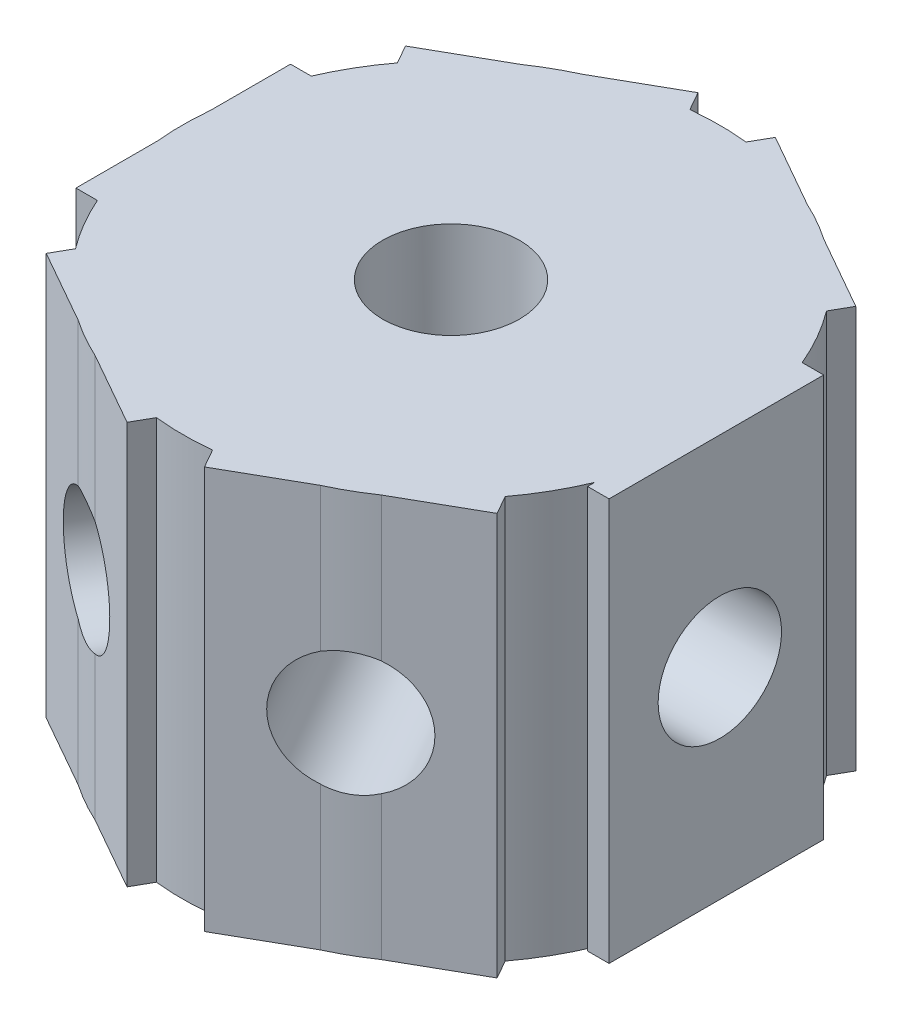
from build123d import *

# Parameters (mm, degrees)
SKETCH1_R               = 12.7
SKETCH1_R_2             = 3.2385
BOSS_EXTRUDE1_DEPTH     = 19.05
BOSS_EXTRUDE2_DEPTH     = 19.05
CUT_EXTRUDE1_DEPTH      = 37.389507521
CUT_EXTRUDE1_DEPTH_BACK = 37.389507521
SKETCH8_R               = 2.921
CUT_EXTRUDE2_DEPTH      = 39.543446664
CUT_EXTRUDE2_DEPTH_BACK = 39.543446664
SKETCH9_R               = 2.921
CUT_EXTRUDE3_DEPTH      = 39.543446664
CUT_EXTRUDE3_DEPTH_BACK = 39.543446664
SKETCH10_R              = 2.921


with BuildPart() as part:
    # Sketch1 → Boss-Extrude1 (new body)
    with BuildSketch(Plane(origin=(0, 0, 0), x_dir=(1, 0, 0), z_dir=(0, 1, 0))):
        with Locations(Location((0, 0, 0), (0, 0, 90))):
            Circle(SKETCH1_R)
        with Locations(Location((0, 0, 0), (0, 0, 90))):
            Circle(SKETCH1_R_2, mode=Mode.SUBTRACT)
    extrude(amount=BOSS_EXTRUDE1_DEPTH)

    # Sketch4 → Boss-Extrude2 (add)
    with BuildSketch(Plane(origin=(0, 0, 0), x_dir=(1, 0, 0), z_dir=(0, 1, 0))):
        with BuildLine():
            Line((11.710261251, -4.915260056), (11.710261251, -5.244739944))
            Line((11.710261251, -5.244739944), (12.726261251, -5.244739944))
            Line((12.726261251, -5.244739944), (12.726261251, 4.915260056))
            Line((12.726261251, 4.915260056), (11.710261251, 4.915260056))
            ThreePointArc((11.710261251, 4.915260056), (12.7, 0), (11.710261251, -4.915260056))
        make_face()
        with BuildLine():
            Line((10.672174567, -8.489929463), (10.169919899, -7.606755501))
            ThreePointArc((10.169919899, -7.606755501), (8.791502438, -9.165123288), (7.177147146, -10.477526371))
            Line((7.177147146, -10.477526371), (10.672174567, -8.489929463))
        make_face()
        with BuildLine():
            Line((10.122975303, 7.669118008), (10.169919899, 7.606755501))
            Line((10.169919899, 7.606755501), (10.672174567, 8.489929463))
            Line((10.672174567, 8.489929463), (7.177147146, 10.477526371))
            ThreePointArc((7.177147146, 10.477526371), (8.763295531, 9.192097227), (10.122975303, 7.669118008))
        make_face()
        with BuildLine():
            ThreePointArc((5.335462361, -11.524879236), (3.382205494, -12.241351477), (1.338180271, -12.62930218))
            Line((1.338180271, -12.62930218), (1.840434939, -13.512476143))
            Line((1.840434939, -13.512476143), (5.335462361, -11.524879236))
        make_face()
        with BuildLine():
            Line((1.840434939, 13.512476143), (1.338180271, 12.62930218))
            ThreePointArc((1.338180271, 12.62930218), (3.382205494, 12.241351477), (5.335462361, 11.524879236))
            Line((5.335462361, 11.524879236), (1.840434939, 13.512476143))
        make_face()
        with BuildLine():
            Line((-1.822827218, -13.514862678), (-1.321723713, -12.63103505))
            ThreePointArc((-1.321723713, -12.63103505), (-3.366252683, -12.245747951), (-5.320441423, -11.531821324))
            Line((-5.320441423, -11.531821324), (-1.822827218, -13.514862678))
        make_face()
        with BuildLine():
            ThreePointArc((-5.320441423, 11.531821324), (-3.366252683, 12.245747951), (-1.321723713, 12.63103505))
            Line((-1.321723713, 12.63103505), (-1.822827218, 13.514862678))
            Line((-1.822827218, 13.514862678), (-5.320441423, 11.531821324))
        make_face()
        with BuildLine():
            ThreePointArc((-7.163489299, -10.486868983), (-8.779553224, -9.176570448), (-10.16, -7.62))
            Line((-10.16, -7.62), (-10.661103505, -8.503827629))
            Line((-10.661103505, -8.503827629), (-7.163489299, -10.486868983))
        make_face()
        with BuildLine():
            Line((-10.661103505, 8.503827629), (-10.16, 7.62))
            ThreePointArc((-10.16, 7.62), (-8.779553224, 9.176570448), (-7.163489299, 10.486868983))
            Line((-7.163489299, 10.486868983), (-10.661103505, 8.503827629))
        make_face()
        with BuildLine():
            Line((-12.637900524, -5.120686304), (-11.621900524, -5.120686304))
            ThreePointArc((-11.621900524, -5.120686304), (-12.282978748, -3.227759762), (-12.637900524, -1.254380467))
            Line((-12.637900524, -1.254380467), (-12.637900524, -5.120686304))
        make_face()
        with BuildLine():
            ThreePointArc((-12.637900524, 1.254380467), (-12.294186241, 3.184805279), (-11.657414699, 5.039313696))
            Line((-11.657414699, 5.039313696), (-12.637900524, 5.039313696))
            Line((-12.637900524, 5.039313696), (-12.637900524, 1.254380467))
        make_face()
    extrude(amount=BOSS_EXTRUDE2_DEPTH)

    # Sketch8 → Cut-Extrude1 (cut, two sides: drawn at the far end of the back side and taken through both)
    with BuildSketch(Plane.ZY.offset(15.177900524).offset(-CUT_EXTRUDE1_DEPTH_BACK)):
        with Locations((0, 9.525)):
            Circle(SKETCH8_R)
    extrude(amount=CUT_EXTRUDE1_DEPTH + CUT_EXTRUDE1_DEPTH_BACK, mode=Mode.SUBTRACT)

    # Sketch9 → Cut-Extrude2 (cut, two sides: drawn at the far end of the back side and taken through both)
    with BuildSketch(Plane(origin=(7.511941423, 0, -13.20913771), x_dir=(-0.8692657113802013, 0, -0.49434514564084964), z_dir=(0.49434514564084964, 0, -0.8692657113802013)).offset(-CUT_EXTRUDE2_DEPTH_BACK)):
        with Locations(Location((0, 9.525, 0), (0, 0, 303.881271432))):
            Circle(SKETCH9_R)
    extrude(amount=CUT_EXTRUDE2_DEPTH + CUT_EXTRUDE2_DEPTH_BACK, mode=Mode.SUBTRACT)

    # Sketch10 → Cut-Extrude3 (cut, two sides: drawn at the far end of the back side and taken through both)
    with BuildSketch(Plane(origin=(7.511941423, 0, 13.20913771), x_dir=(0.8692657113802004, 0, -0.494345145640851), z_dir=(0.494345145640851, 0, 0.8692657113802004)).offset(-CUT_EXTRUDE3_DEPTH_BACK)):
        with Locations(Location((0, 9.525, 0), (0, 0, 56.764721603))):
            Circle(SKETCH10_R)
    extrude(amount=CUT_EXTRUDE3_DEPTH + CUT_EXTRUDE3_DEPTH_BACK, mode=Mode.SUBTRACT)


solid = part.part
